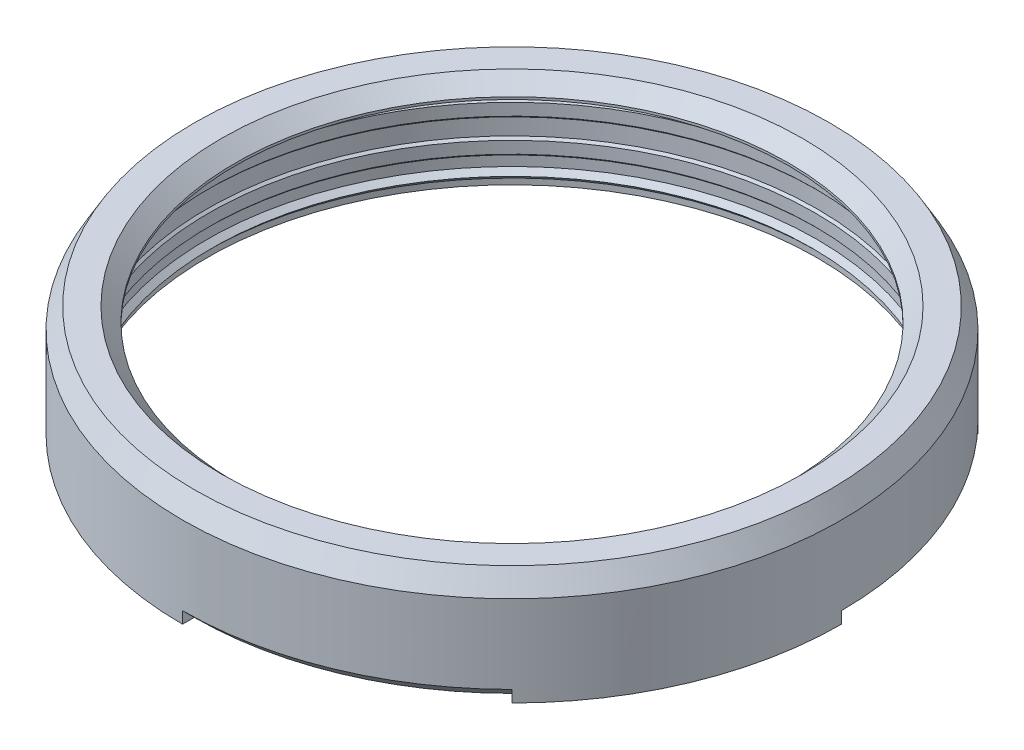
from build123d import *

# Parameters (mm, degrees)
SKETCH_1_R               = 28
EXTRUDE_1_DEPTH          = 2
SKETCH_4_R               = 23.5
CUT_EXTRUDE_1_DEPTH      = 41.841155713
CUT_EXTRUDE_START        = -0.6
SKETCH_5_R               = 28
CUT_EXTRUDE_2_DEPTH      = 0.6
CHAMFER_1_SIZE           = 1.2
CHAMFER_2_SIZE           = 1.732
CHAMFER_2_SIZE2          = 0.999970666
CUT_REVOLVE_1_ANGLE      = 45
PATTERN_CIRCULAR_1_COUNT = 4
SKETCH_8_R               = 24.78
SKETCH_8_R_2             = 24.32
EXTRUDE_2_DEPTH          = 0.5


with BuildPart() as part:
    # 草图1 → 凸台-拉伸1 (new body)
    with BuildSketch(Plane(origin=(0, 0, 0), x_dir=(1, 0, 0), z_dir=(0, 1, 0))):
        with Locations(Location((0, 0, 0), (0, 0, 270))):
            Circle(SKETCH_1_R)
    extrude(amount=EXTRUDE_1_DEPTH)

    # 草图2 → 旋转1 (revolve)
    with BuildSketch(Plane(origin=(0, 0, 0), x_dir=(-0.9702957262759954, 0, -0.24192189559967248), z_dir=(0.24192189559967245, 0, -0.9702957262759953)), mode=Mode.PRIVATE) as revolve_1_sk:
        with BuildLine():
            Line((25.93, -8), (25.93, -7.5))
            Line((25.93, -7.5), (25.505, -7.075))
            Line((25.505, -7.075), (25.93, -6.65))
            Line((25.93, -6.65), (25.93, -5.8))
            Line((25.93, -5.8), (25.74, -5.61))
            Line((25.74, -5.61), (25.74, -4.59))
            Line((25.74, -4.59), (25.93, -4.4))
            Line((25.93, -4.4), (25.93, -3))
            Line((25.93, -3), (25.74, -2.81))
            Line((25.74, -2.81), (25.74, -1.79))
            Line((25.74, -1.79), (25.93, -1.6))
            Line((25.93, -1.6), (25.93, -1.4))
            ThreePointArc((25.93, -1.4), (25.519949494, -0.410050506), (24.53, 0))
            Line((24.53, 0), (28, 0))
            Line((28, 0), (28, -8))
            Line((28, -8), (25.93, -8))
        make_face()
    revolve(revolve_1_sk.sketch.rotate(Axis((0, 0, 0), (0, 1, 0)), 284), axis=Axis((0, 0, 0), (0, 1, 0)))

    # 草图4 → 切除-拉伸1 (cut, through all)
    with BuildSketch(Plane(origin=(0, 2, 0), x_dir=(1, 0, 0), z_dir=(0, 1, 0))):
        with Locations(Location((0, 0, 0), (0, 0, 270))):
            Circle(SKETCH_4_R)
    extrude(amount=-CUT_EXTRUDE_1_DEPTH, mode=Mode.SUBTRACT)

    # 草图5 → 切除-拉伸2 (cut)
    with BuildSketch(Plane(origin=(0, 2, 0), x_dir=(1, 0, 0), z_dir=(0, 1, 0)).offset(CUT_EXTRUDE_START)):
        with Locations(Location((0, 0, 0), (0, 0, 90))):
            Circle(SKETCH_5_R)
    extrude(amount=CUT_EXTRUDE_2_DEPTH, mode=Mode.SUBTRACT)

    # 倒角1
    chamfer_1_edges = [part.edges().sort_by_distance(p)[0] for p in [
        (0, 1.4, -23.5),
    ]]
    chamfer(chamfer_1_edges, length=CHAMFER_1_SIZE)

    # 倒角2
    chamfer_2_edges = [part.edges().sort_by_distance(p)[0] for p in [
        (0, 1.4, -28),
    ]]
    chamfer_2_side = [part.faces().sort_by_distance(p)[0] for p in [
        (0, 0.7, -28),
    ]]
    chamfer(chamfer_2_edges, length=CHAMFER_2_SIZE, length2=CHAMFER_2_SIZE2, reference=chamfer_2_side[0])

    # 草图7 → 切除-旋转1 (revolve, cut)
    with BuildSketch(Plane.XY):
        Polygon((28, -8), (28, -7), (27, -8), align=None)
    cut_revolve_1 = revolve(axis=Axis((0, 0, 0), (0, 1, 0)), revolution_arc=CUT_REVOLVE_1_ANGLE, mode=Mode.SUBTRACT)

    # 阵列(圆周)1: 切除-旋转1 ×4 about axis
    pattern_circular_1_axis = Axis((0, 0, 0), (0, 1, 0))
    for i in range(1, PATTERN_CIRCULAR_1_COUNT):
        add(cut_revolve_1.rotate(pattern_circular_1_axis, i * 360 / PATTERN_CIRCULAR_1_COUNT), mode=Mode.SUBTRACT)

    # 草图8 → 凸台-拉伸2 (add)
    with BuildSketch(Plane.XZ):
        with Locations(Location((0, 0, 0), (0, 0, 270))):
            Circle(SKETCH_8_R)
        with Locations(Location((0, 0, 0), (0, 0, 270))):
            Circle(SKETCH_8_R_2, mode=Mode.SUBTRACT)
    extrude(amount=EXTRUDE_2_DEPTH)


solid = part.part
